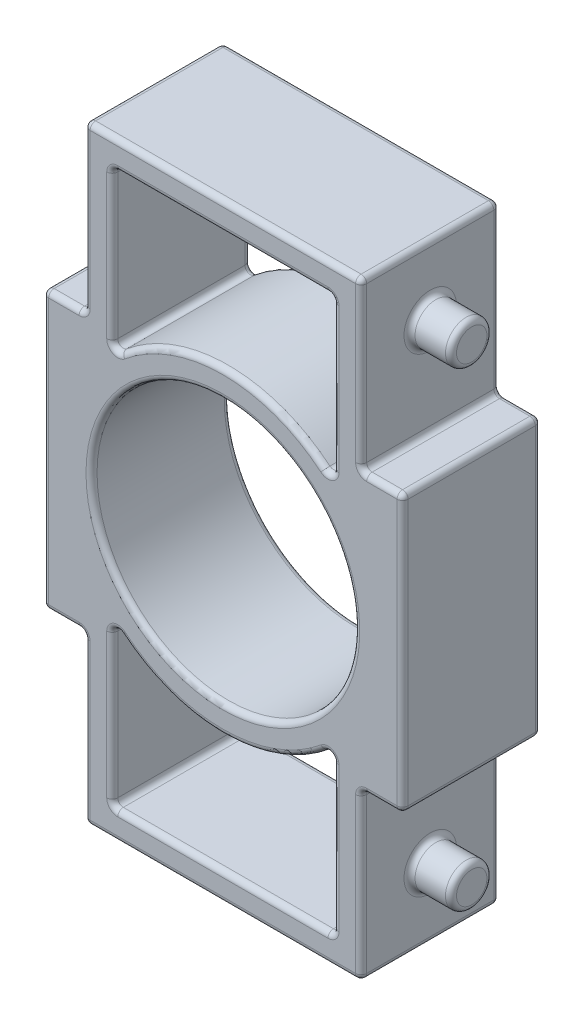
from build123d import *

# Parameters (mm, degrees)
SKETCH1_W           = 50
SKETCH1_H           = 220
BOSS_EXTRUDE1_DEPTH = 50
SKETCH2_R           = 7.5
BOSS_EXTRUDE2_DEPTH = 15
SKETCH5_W           = 15
SKETCH5_H           = 100
BOSS_EXTRUDE3_DEPTH = 50
SKETCH3_R           = 47.5
CUT_EXTRUDE1_DEPTH  = 138.20422734
CUT_EXTRUDE2_DEPTH  = 138.20422734
FILLET1_R           = 2


with BuildPart() as part:
    # Sketch1 → Boss-Extrude1 (new, symmetric)
    with BuildSketch(Plane(origin=(0, 0, 0), x_dir=(0, 0, -1), z_dir=(1, 0, 0))):
        Rectangle(SKETCH1_W, SKETCH1_H)
    extrude(amount=BOSS_EXTRUDE1_DEPTH, both=True)

    # Sketch2 → Boss-Extrude2 (add)
    with BuildSketch(Plane(origin=(50, 0, 0), x_dir=(0, 0, -1), z_dir=(1, 0, 0))):
        with Locations((0, 85)):
            Circle(SKETCH2_R)
        with Locations((0, -85)):
            Circle(SKETCH2_R)
    boss_extrude2 = extrude(amount=BOSS_EXTRUDE2_DEPTH)

    # Mirror1: Boss-Extrude2 across plane
    add(boss_extrude2.mirror(Plane(origin=(0, 0, 0), x_dir=(0, 0, 1), z_dir=(1, 0, 0))))

    # Sketch5 → Boss-Extrude3 (add)
    with BuildSketch(Plane.XY.offset(25)):
        with Locations((-57.5, 0)):
            Rectangle(SKETCH5_W, SKETCH5_H)
    boss_extrude3 = extrude(amount=-BOSS_EXTRUDE3_DEPTH)

    # Mirror2: Boss-Extrude3 across plane
    add(boss_extrude3.mirror(Plane(origin=(0, 0, 0), x_dir=(0, 0, 1), z_dir=(1, 0, 0))))

    # Sketch3 → Cut-Extrude1 (cut, through all)
    with BuildSketch(Plane(origin=(0, 0, -25), x_dir=(-1, 0, 0), z_dir=(0, 0, -1))):
        Circle(SKETCH3_R)
    extrude(amount=-CUT_EXTRUDE1_DEPTH, mode=Mode.SUBTRACT)

    # Sketch4 → Cut-Extrude2 (cut, through all)
    with BuildSketch(Plane(origin=(0, 0, -25), x_dir=(-1, 0, 0), z_dir=(0, 0, -1))):
        with BuildLine():
            Line((40, -100), (40, -41.306779105))
            ThreePointArc((40, -41.306779105), (0, -57.5), (-40, -41.306779105))
            Line((-40, -41.306779105), (-40, -100))
            Line((-40, -100), (40, -100))
        make_face()
        with BuildLine():
            Line((40, 100), (-40, 100))
            Line((-40, 100), (-40, 41.306779105))
            ThreePointArc((-40, 41.306779105), (0, 57.5), (40, 41.306779105))
            Line((40, 41.306779105), (40, 100))
        make_face()
    extrude(amount=-CUT_EXTRUDE2_DEPTH, mode=Mode.SUBTRACT)

    # Fillet1
    fillet1_edges = [part.edges().sort_by_distance(p)[0] for p in [
        (50, -80, -25),
        (50, 85, 7.5),
        (65, 85, 7.5),
        (50, 110, 0),
        (50, -85, 7.5),
        (65, -85, 7.5),
        (-65, 85, 7.5),
        (-50, 85, 7.5),
        (-65, -85, 7.5),
        (-50, -85, 7.5),
        (-50, -80, 25),
        (-50, 80, -25),
        (-50, 50, 0),
        (-50, -50, 0),
        (-65, -50, 0),
        (-65, 50, 0),
        (-57.5, 50, 25),
        (-65, 0, 25),
        (-57.5, -50, 25),
        (-57.5, -50, -25),
        (-65, 0, -25),
        (-57.5, 50, -25),
        (50, -80, 25),
        (50, 80, -25),
        (57.5, -50, -25),
        (65, -50, 0),
        (57.5, -50, 25),
        (65, 0, -25),
        (65, 50, 0),
        (65, 0, 25),
        (57.5, 50, -25),
        (50, 50, 0),
        (57.5, 50, 25),
        (50, -50, 0),
        (50, 80, 25),
        (-50, 110, 0),
        (-50, -80, -25),
        (47.5, 0, 25),
        (47.5, 0, -25),
        (-50, -110, 0),
        (-50, 80, 25),
        (0, -57.5, 25),
        (40, -41.306779105, 0),
        (-40, -70.653389552, 25),
        (-40, -41.306779105, 0),
        (0, -100, 25),
        (-40, -100, 0),
        (40, -70.653389552, 25),
        (40, -100, 0),
        (0, -57.5, -25),
        (40, -70.653389552, -25),
        (0, -100, -25),
        (-40, -70.653389552, -25),
        (0, 57.5, 25),
        (-40, 41.306779105, 0),
        (40, 70.653389552, 25),
        (40, 41.306779105, 0),
        (0, 100, 25),
        (40, 100, 0),
        (-40, 70.653389552, 25),
        (-40, 100, 0),
        (0, 57.5, -25),
        (-40, 70.653389552, -25),
        (0, 110, 25),
        (0, 100, -25),
        (40, 70.653389552, -25),
        (0, 110, -25),
        (0, -110, -25),
        (0, -110, 25),
        (50, -110, 0),
    ]]
    fillet(fillet1_edges, radius=FILLET1_R)


solid = part.part
